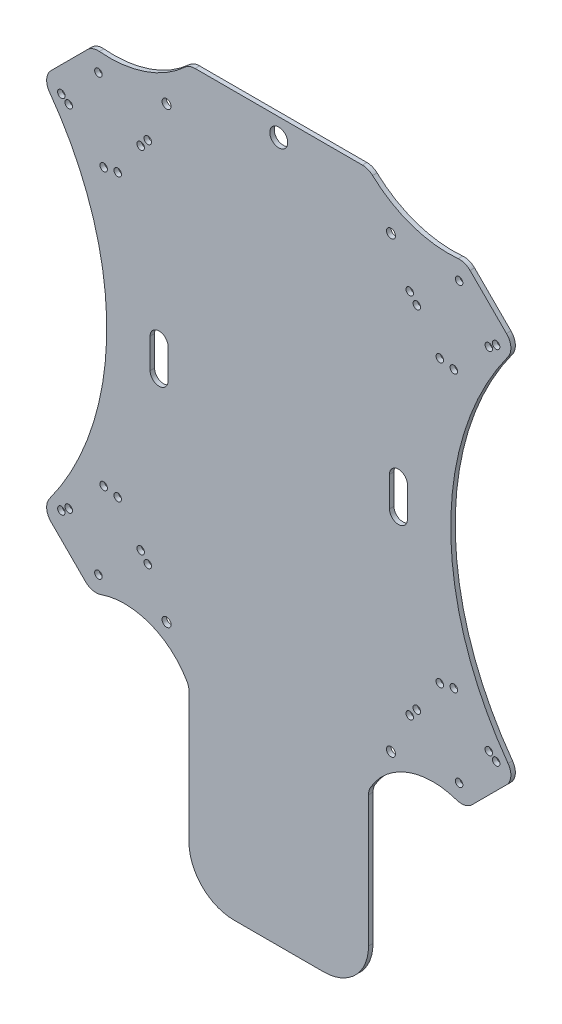
from build123d import *

# Parameters (mm, degrees)
SKETCH2_R           = 1.5
SKETCH2_R_2         = 3
BOSS_EXTRUDE1_DEPTH = 1.5
SKETCH3_R           = 1.25
F_45_DEGREES_DEPTH  = 170.629743854
SKETCH4_R           = 1.25
F_35_DEGRESS_DEPTH  = 170.629743854
FILLET1_R           = 5
FILLET2_R           = 5
FILLET3_R           = 5
FILLET4_R           = 5
FILLET5_R           = 5
FILLET6_R           = 5
FILLET7_R           = 5
FILLET8_R           = 5
FILLET10_R          = 5
FILLET11_R          = 5
FILLET12_R          = 5
FILLET13_R          = 5


with BuildPart() as part:
    # Sketch2 → Boss-Extrude1 (new body)
    with BuildSketch(Plane.XY):
        with BuildLine():
            Line((-79.195959493, 62.225396744), (-62.225396744, 79.195959493))
            ThreePointArc((-62.225396744, 79.195959493), (-44.806778225, 80.702789346), (-30, 90))
            Line((-30, 90), (30, 90))
            ThreePointArc((30, 90), (44.806778225, 80.702789346), (62.225396744, 79.195959493))
            Line((62.225396744, 79.195959493), (79.195959493, 62.225396744))
            ThreePointArc((79.195959493, 62.225396744), (57.477502656, 0), (79.195959493, -62.225396744))
            Line((79.195959493, -62.225396744), (62.225396744, -79.195959493))
            ThreePointArc((62.225396744, -79.195959493), (43.875108319, -77.923881554), (30, -90))
            Line((30, -90), (30, -135))
            ThreePointArc((30, -135), (25.606601718, -145.606601718), (15, -150))
            Line((15, -150), (-15, -150))
            ThreePointArc((-15, -150), (-25.606601718, -145.606601718), (-30, -135))
            Line((-30, -135), (-30, -90))
            ThreePointArc((-30, -90), (-43.875108319, -77.923881554), (-62.225396744, -79.195959493))
            Line((-62.225396744, -79.195959493), (-79.195959493, -62.225396744))
            ThreePointArc((-79.195959493, -62.225396744), (-57.477502656, 0), (-79.195959493, 62.225396744))
        make_face()
        with Locations((-37.5, 75)):
            Circle(SKETCH2_R, mode=Mode.SUBTRACT)
        with Locations((37.5, 75)):
            Circle(SKETCH2_R, mode=Mode.SUBTRACT)
        with Locations((37.5, -75)):
            Circle(SKETCH2_R, mode=Mode.SUBTRACT)
        with Locations((-37.5, -75)):
            Circle(SKETCH2_R, mode=Mode.SUBTRACT)
        with Locations((0, 84)):
            Circle(SKETCH2_R_2, mode=Mode.SUBTRACT)
        with BuildLine():
            Line((43, 5), (43, -5))
            ThreePointArc((43, -5), (40, -8), (37, -5))
            Line((37, -5), (37, 5))
            ThreePointArc((37, 5), (40, 8), (43, 5))
        make_face(mode=Mode.SUBTRACT)
        with BuildLine():
            Line((-43, 5), (-43, -5))
            ThreePointArc((-43, -5), (-40, -8), (-37, -5))
            Line((-37, -5), (-37, 5))
            ThreePointArc((-37, 5), (-40, 8), (-43, 5))
        make_face(mode=Mode.SUBTRACT)
    extrude(amount=BOSS_EXTRUDE1_DEPTH)

    # Sketch3 → 45 Degrees (cut, through all)
    with BuildSketch(Plane.XY.offset(1.5)):
        with Locations((-72.655221767, 60.280853096)):
            Circle(SKETCH3_R)
        with Locations((-58.513086143, 46.138717472)):
            Circle(SKETCH3_R)
        with Locations(Location((-60.280853096, 72.655221767, 0), (0, 0, 180))):
            Circle(SKETCH3_R)
        with Locations(Location((-46.138717472, 58.513086143, 0), (0, 0, 180))):
            Circle(SKETCH3_R)
        with Locations(Location((58.513086143, 46.138717472, 0), (0, 0, 180))):
            Circle(SKETCH3_R)
        with Locations(Location((72.655221767, 60.280853096, 0), (0, 0, 180))):
            Circle(SKETCH3_R)
        with Locations((60.280853096, 72.655221767)):
            Circle(SKETCH3_R)
        with Locations((46.138717472, 58.513086143)):
            Circle(SKETCH3_R)
        with Locations(Location((-58.513086143, -46.138717472, 0), (0, 0, 180))):
            Circle(SKETCH3_R)
        with Locations((-46.138717472, -58.513086143)):
            Circle(SKETCH3_R)
        with Locations((-60.280853096, -72.655221767)):
            Circle(SKETCH3_R)
        with Locations(Location((-72.655221767, -60.280853096, 0), (0, 0, 180))):
            Circle(SKETCH3_R)
        with Locations((58.513086143, -46.138717472)):
            Circle(SKETCH3_R)
        with Locations((72.655221767, -60.280853096)):
            Circle(SKETCH3_R)
        with Locations(Location((60.280853096, -72.655221767, 0), (0, 0, 180))):
            Circle(SKETCH3_R)
        with Locations(Location((46.138717472, -58.513086143, 0), (0, 0, 180))):
            Circle(SKETCH3_R)
    extrude(amount=-F_45_DEGREES_DEPTH, mode=Mode.SUBTRACT)

    # Sketch4 → 35 Degress (cut, through all)
    with BuildSketch(Plane.XY.offset(1.5)):
        with Locations((-70.197055442, 58.493417152)):
            Circle(SKETCH4_R)
        with Locations(Location((-60.280853096, 72.655221767, 0), (0, 0, 180))):
            Circle(SKETCH4_R)
        with Locations((60.280853096, 72.655221767)):
            Circle(SKETCH4_R)
        with Locations((-43.777344125, 61.357691434)):
            Circle(SKETCH4_R)
        with Locations((-53.814014556, 47.021888425)):
            Circle(SKETCH4_R)
        with Locations(Location((43.777344125, 61.357691434, 0), (0, 0, 180))):
            Circle(SKETCH4_R)
        with Locations(Location((53.814014556, 47.021888425, 0), (0, 0, 180))):
            Circle(SKETCH4_R)
        with Locations(Location((70.197055442, 58.493417152, 0), (0, 0, 180))):
            Circle(SKETCH4_R)
        with Locations(Location((60.280853096, -72.655221767, 0), (0, 0, 180))):
            Circle(SKETCH4_R)
        with Locations((70.197055442, -58.493417152)):
            Circle(SKETCH4_R)
        with Locations((43.777344125, -61.357691434)):
            Circle(SKETCH4_R)
        with Locations((53.814014556, -47.021888425)):
            Circle(SKETCH4_R)
        with Locations((-60.280853096, -72.655221767)):
            Circle(SKETCH4_R)
        with Locations(Location((-53.814014556, -47.021888425, 0), (0, 0, 180))):
            Circle(SKETCH4_R)
        with Locations(Location((-43.777344125, -61.357691434, 0), (0, 0, 180))):
            Circle(SKETCH4_R)
        with Locations(Location((-70.197055442, -58.493417152, 0), (0, 0, 180))):
            Circle(SKETCH4_R)
    extrude(amount=-F_35_DEGRESS_DEPTH, mode=Mode.SUBTRACT)

    # Fillet1
    fillet1_edges = [part.edges().sort_by_distance(p)[0] for p in [
        (-30, 90, 0.75),
    ]]
    fillet(fillet1_edges, radius=FILLET1_R)

    # Fillet2
    fillet2_edges = [part.edges().sort_by_distance(p)[0] for p in [
        (-79.195959493, 62.225396744, 0.75),
    ]]
    fillet(fillet2_edges, radius=FILLET2_R)

    # Fillet3
    fillet3_edges = [part.edges().sort_by_distance(p)[0] for p in [
        (-62.225396744, 79.195959493, 0.75),
    ]]
    fillet(fillet3_edges, radius=FILLET3_R)

    # Fillet4
    fillet4_edges = [part.edges().sort_by_distance(p)[0] for p in [
        (62.225396744, 79.195959493, 0.75),
    ]]
    fillet(fillet4_edges, radius=FILLET4_R)

    # Fillet5
    fillet5_edges = [part.edges().sort_by_distance(p)[0] for p in [
        (30, 90, 0.75),
    ]]
    fillet(fillet5_edges, radius=FILLET5_R)

    # Fillet6
    fillet6_edges = [part.edges().sort_by_distance(p)[0] for p in [
        (79.195959493, 62.225396744, 0.75),
    ]]
    fillet(fillet6_edges, radius=FILLET6_R)

    # Fillet7
    fillet7_edges = [part.edges().sort_by_distance(p)[0] for p in [
        (79.195959493, -62.225396744, 0.75),
    ]]
    fillet(fillet7_edges, radius=FILLET7_R)

    # Fillet8
    fillet8_edges = [part.edges().sort_by_distance(p)[0] for p in [
        (62.225396744, -79.195959493, 0.75),
    ]]
    fillet(fillet8_edges, radius=FILLET8_R)

    # Fillet10
    fillet10_edges = [part.edges().sort_by_distance(p)[0] for p in [
        (30, -90, 0.75),
    ]]
    fillet(fillet10_edges, radius=FILLET10_R)

    # Fillet11
    fillet11_edges = [part.edges().sort_by_distance(p)[0] for p in [
        (-30, -90, 0.75),
    ]]
    fillet(fillet11_edges, radius=FILLET11_R)

    # Fillet12
    fillet12_edges = [part.edges().sort_by_distance(p)[0] for p in [
        (-79.195959493, -62.225396744, 0.75),
    ]]
    fillet(fillet12_edges, radius=FILLET12_R)

    # Fillet13
    fillet13_edges = [part.edges().sort_by_distance(p)[0] for p in [
        (-62.225396744, -79.195959493, 0.75),
    ]]
    fillet(fillet13_edges, radius=FILLET13_R)


solid = part.part
